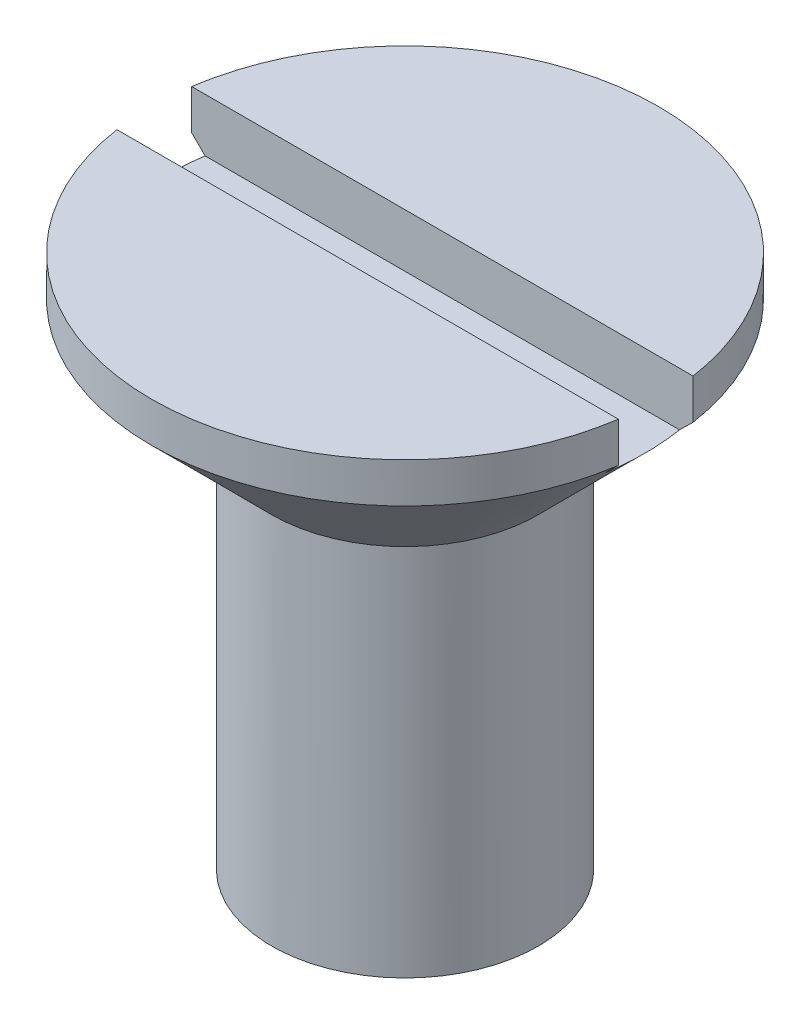
from build123d import *

# Parameters (mm, degrees)
CUT_EXTRUDE_1_DEPTH = 0.4


with BuildPart() as part:
    # Эскиз1 → Revolve 278 (revolve)
    with BuildSketch(Plane.XY, mode=Mode.PRIVATE) as revolve_278_sk:
        Polygon((0, 0), (1, 0), (1, 2.8), (1.9, 3.7), (1.9, 4), (0, 4), align=None)
    revolve(revolve_278_sk.sketch.rotate(Axis((0, 0, 0), (0, 1, 0)), 351.050981935), axis=Axis((0, 0, 0), (0, 1, 0)))

    # Эскиз2 → Вырез-Вытянуть1 (cut)
    with BuildSketch(Plane(origin=(0, 4, 0), x_dir=(-1, 0, 0), z_dir=(0, 1, 0))):
        with BuildLine():
            Line((-1.879255172, -0.28), (1.879255172, -0.28))
            ThreePointArc((1.879255172, -0.28), (1.9, 0), (1.879255172, 0.28))
            Line((1.879255172, 0.28), (-1.879255172, 0.28))
            ThreePointArc((-1.879255172, 0.28), (-1.9, 0), (-1.879255172, -0.28))
        make_face()
    extrude(amount=-CUT_EXTRUDE_1_DEPTH, mode=Mode.SUBTRACT)


solid = part.part
